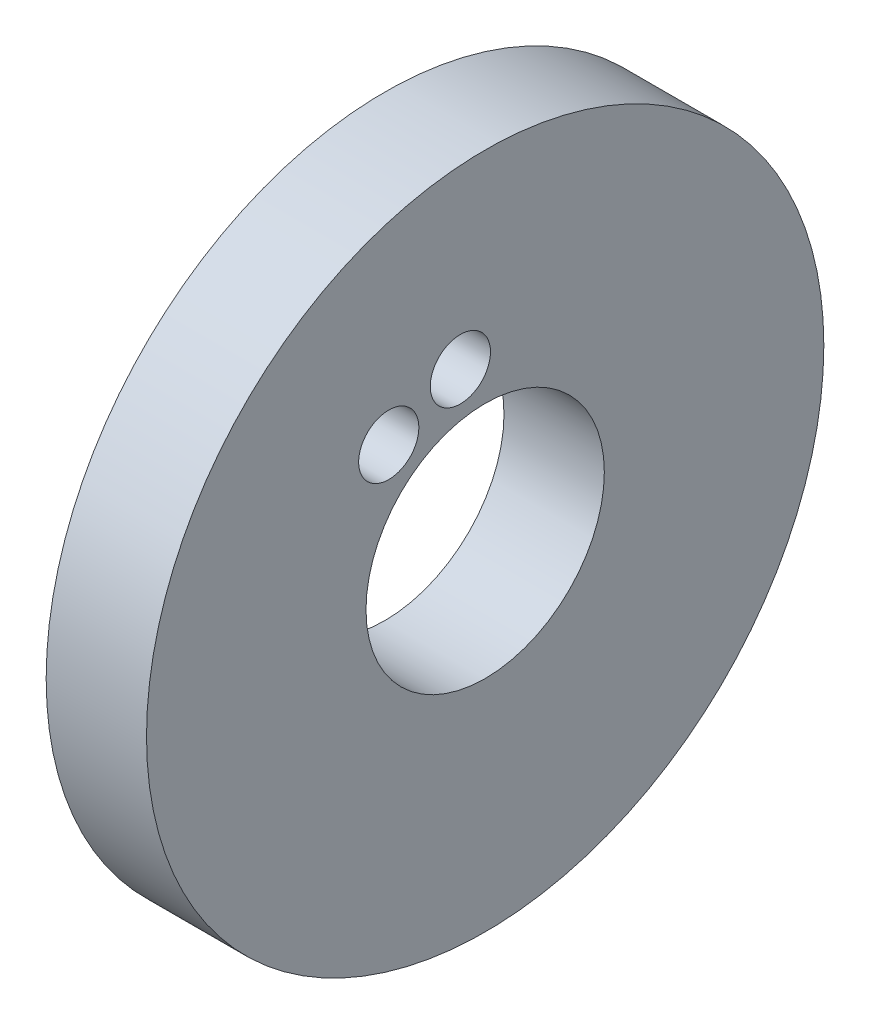
from build123d import *

# Parameters (mm, degrees)
AXIAL_PROFILE_MM_W     = 8
AXIAL_PROFILE_MM_H     = 17.5
AXIAL_HOLES_DEPTH      = 149.686549493
AXIAL_HOLES_DEPTH_BACK = 149.686549493
SKETCH2_R              = 2.4


with BuildPart() as part:
    # Axial profile (mm) → Full revolution (revolve)
    with BuildSketch(Plane.XY, mode=Mode.PRIVATE) as full_revolution_sk:
        with Locations((139.7, 18.25)):
            Rectangle(AXIAL_PROFILE_MM_W, AXIAL_PROFILE_MM_H)
    revolve(full_revolution_sk.sketch.rotate(Axis((-110, 0, 0), (1, 0, 0)), 90), axis=Axis((-110, 0, 0), (1, 0, 0)))

    # Sketch2 → Axial holes (cut, two sides: drawn at the far end of the back side and taken through both)
    with BuildSketch(Plane(origin=(0, 0, 0), x_dir=(0, 0, -1), z_dir=(1, 0, 0)).offset(-AXIAL_HOLES_DEPTH_BACK)):
        with Locations((-1.977382665, 12.848733704)):
            Circle(SKETCH2_R)
        with Locations((-7.687206041, 10.483647423)):
            Circle(SKETCH2_R)
    extrude(amount=AXIAL_HOLES_DEPTH + AXIAL_HOLES_DEPTH_BACK, mode=Mode.SUBTRACT)


solid = part.part
